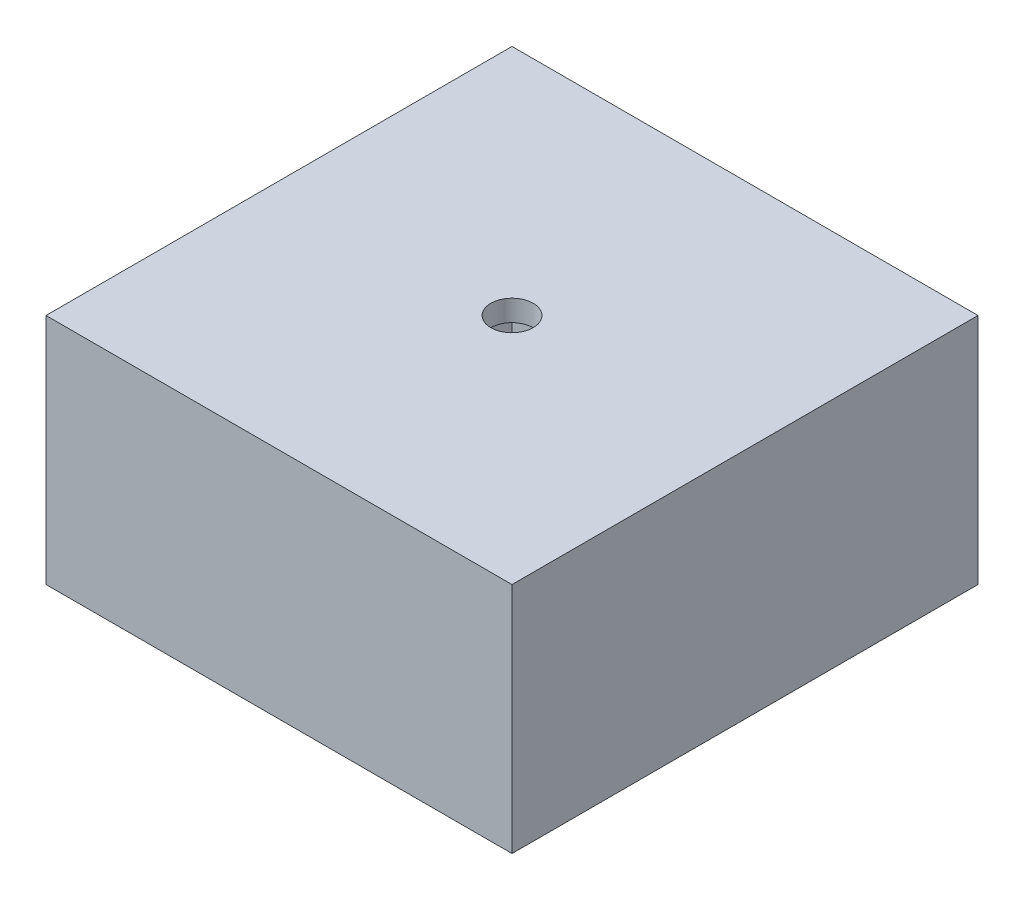
from build123d import *

# Parameters (mm, degrees)
SKETCH_1_W          = 44
SKETCH_1_H          = 44
SKETCH_1_W_2        = 40
SKETCH_1_H_2        = 40
EXTRUDE_1_DEPTH     = 20
SKETCH_2_W          = 44
SKETCH_2_H          = 44
EXTRUDE_1_2_DEPTH   = 2
SKETCH_3_R          = 2
CUT_EXTRUDE_1_DEPTH = 2


with BuildPart() as part:
    # 草图1 → Extrude 1 (new body)
    with BuildSketch(Plane(origin=(0, 0, 0), x_dir=(1, 0, 0), z_dir=(0, 1, 0))):
        Rectangle(SKETCH_1_W, SKETCH_1_H)
        Rectangle(SKETCH_1_W_2, SKETCH_1_H_2, mode=Mode.SUBTRACT)
    extrude(amount=EXTRUDE_1_DEPTH)

    # 草图2 → Extrude 1 2 (add)
    with BuildSketch(Plane(origin=(0, 20, 0), x_dir=(1, 0, 0), z_dir=(0, 1, 0))):
        Rectangle(SKETCH_2_W, SKETCH_2_H)
    extrude(amount=EXTRUDE_1_2_DEPTH)

    # 草图3 → 切除-拉伸1 (cut)
    with BuildSketch(Plane(origin=(0, 22, 0), x_dir=(1, 0, 0), z_dir=(0, 1, 0))):
        with Locations(Location((0, 0, 0), (0, 0, 270))):
            Circle(SKETCH_3_R)
    extrude(amount=-CUT_EXTRUDE_1_DEPTH, mode=Mode.SUBTRACT)


solid = part.part
